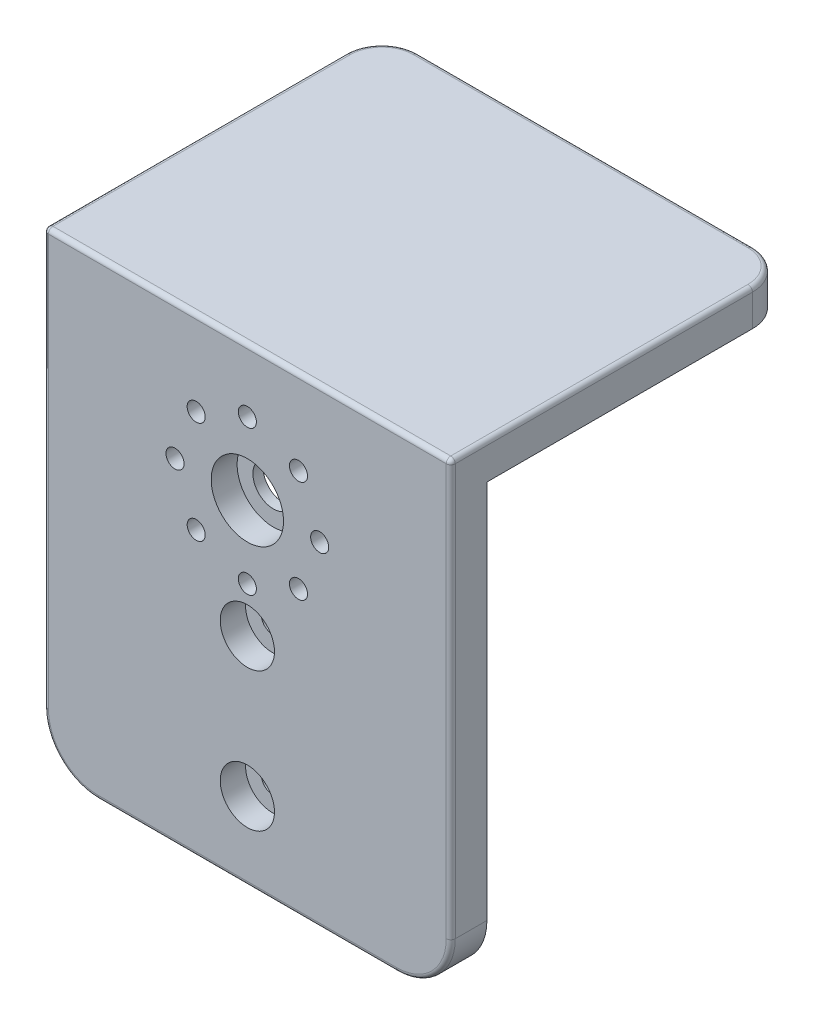
from build123d import *

# Parameters (mm, degrees)
BOSS_EXTRUDE1_DEPTH = 4
SKETCH2_W           = 45
SKETCH2_H           = 4
BOSS_EXTRUDE2_DEPTH = 48
SKETCH3_R           = 1.25
CUT_EXTRUDE1_DEPTH  = 63.645625546
FILLET1_R           = 6
FILLET2_R           = 0.5
SKETCH6_R           = 2.255
CUT_EXTRUDE2_DEPTH  = 63.645625582
SKETCH7_R           = 1
CUT_EXTRUDE3_DEPTH  = 63.645625582
SKETCH8_R           = 4
CUT_EXTRUDE4_DEPTH  = 2.87
SKETCH9_R           = 3
CUT_EXTRUDE5_DEPTH  = 2.8
SKETCH10_R          = 2
SKETCH10_R_2        = 1.95
BOSS_EXTRUDE3_DEPTH = 3


with BuildPart() as part:
    # Sketch1 → Boss-Extrude1 (new body)
    with BuildSketch(Plane(origin=(0, 0, 0), x_dir=(1, 0, 0), z_dir=(0, 1, 0))):
        with BuildLine():
            Line((-22.5, -16.69), (22.5, -16.69))
            Line((22.5, -16.69), (22.5, 16.69))
            ThreePointArc((22.5, 16.69), (21.328427125, 19.518427125), (18.5, 20.69))
            Line((18.5, 20.69), (-18.5, 20.69))
            ThreePointArc((-18.5, 20.69), (-21.328427125, 19.518427125), (-22.5, 16.69))
            Line((-22.5, 16.69), (-22.5, -16.69))
        make_face()
    extrude(amount=BOSS_EXTRUDE1_DEPTH)

    # Sketch2 → Boss-Extrude2 (add)
    with BuildSketch(Plane.XZ):
        with Locations((0, 14.69)):
            Rectangle(SKETCH2_W, SKETCH2_H)
    extrude(amount=BOSS_EXTRUDE2_DEPTH)

    # Sketch3 → Cut-Extrude1 (cut, through all)
    with BuildSketch(Plane(origin=(0, 0, 12.69), x_dir=(-1, 0, 0), z_dir=(0, 0, -1))):
        with Locations((0, -39.35)):
            Circle(SKETCH3_R)
        with Locations((0, -24)):
            Circle(SKETCH3_R)
    extrude(amount=-CUT_EXTRUDE1_DEPTH, mode=Mode.SUBTRACT)

    # Fillet1
    fillet1_edges = [part.edges().sort_by_distance(p)[0] for p in [
        (-22.5, -48, 14.69),
        (22.5, -48, 14.69),
    ]]
    fillet(fillet1_edges, radius=FILLET1_R)

    # Fillet2
    fillet2_edges = [part.edges().sort_by_distance(p)[0] for p in [
        (22.5, -19, 16.69),
        (-22.5, -19, 16.69),
        (22.5, 4, 0),
        (21.328427125, 4, -19.518427125),
        (0, 4, -20.69),
        (-21.328427125, 4, -19.518427125),
        (0, -48, 16.69),
        (-20.742640687, -46.242640687, 16.69),
        (20.742640687, -46.242640687, 16.69),
        (-22.5, 4, 0),
        (0, 4, 16.69),
    ]]
    fillet(fillet2_edges, radius=FILLET2_R)

    # Sketch6 → Cut-Extrude2 (cut, through all)
    with BuildSketch(Plane(origin=(0, 0, 12.69), x_dir=(-1, 0, 0), z_dir=(0, 0, -1))):
        with Locations((0, -11)):
            Circle(SKETCH6_R)
    extrude(amount=-CUT_EXTRUDE2_DEPTH, mode=Mode.SUBTRACT)

    # Sketch7 → Cut-Extrude3 (cut, through all)
    with BuildSketch(Plane(origin=(0, 0, 12.69), x_dir=(-1, 0, 0), z_dir=(0, 0, -1))):
        with Locations((0, -19)):
            Circle(SKETCH7_R)
        with Locations((-5.656854249, -16.656854249)):
            Circle(SKETCH7_R)
        with Locations((-8, -11)):
            Circle(SKETCH7_R)
        with Locations((-5.656854249, -5.343145751)):
            Circle(SKETCH7_R)
        with Locations((0, -3)):
            Circle(SKETCH7_R)
        with Locations((5.656854249, -5.343145751)):
            Circle(SKETCH7_R)
        with Locations((8, -11)):
            Circle(SKETCH7_R)
        with Locations((5.656854249, -16.656854249)):
            Circle(SKETCH7_R)
    extrude(amount=-CUT_EXTRUDE3_DEPTH, mode=Mode.SUBTRACT)

    # Sketch8 → Cut-Extrude4 (cut)
    with BuildSketch(Plane.XY.offset(16.69)):
        with Locations((0, -11)):
            Circle(SKETCH8_R)
    extrude(amount=-CUT_EXTRUDE4_DEPTH, mode=Mode.SUBTRACT)

    # Sketch9 → Cut-Extrude5 (cut)
    with BuildSketch(Plane.XY.offset(16.69)):
        with Locations((0, -24)):
            Circle(SKETCH9_R)
        with Locations((0, -39.35)):
            Circle(SKETCH9_R)
    extrude(amount=-CUT_EXTRUDE5_DEPTH, mode=Mode.SUBTRACT)

    # Sketch10 → Boss-Extrude3 (add)
    with BuildSketch(Plane.XZ):
        with Locations(Location((16.5, -16.17, 0), (0, 0, 90))):
            Circle(SKETCH10_R)
        with Locations(Location((16.5, -4.17, 0), (0, 0, 90))):
            Circle(SKETCH10_R_2)
    extrude(amount=BOSS_EXTRUDE3_DEPTH)


solid = part.part
